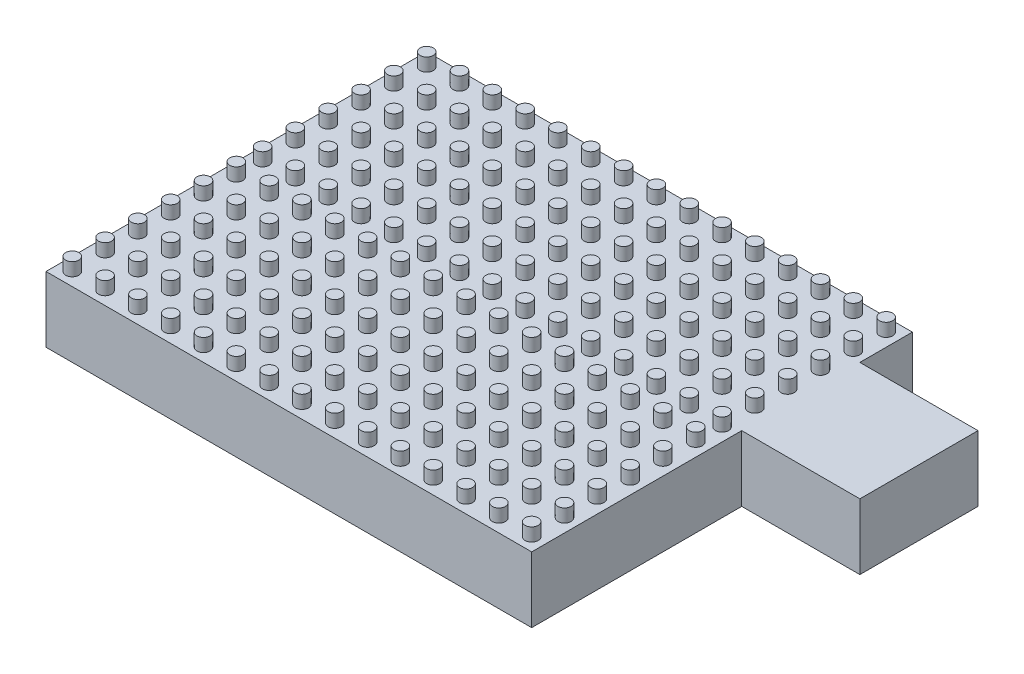
from build123d import *

# Parameters (mm, degrees)
SKETCH_1_W      = 740
SKETCH_1_H      = 580
EXTRUDE_1_DEPTH = 100
SKETCH_2_R      = 10
EXTRUDE_3_DEPTH = 20
SKETCH_3_W      = 180
SKETCH_3_H      = 100
EXTRUDE_4_DEPTH = 180


with BuildPart() as part:
    # 草图1 → 凸台-拉伸1 (new body)
    with BuildSketch(Plane(origin=(0, 0, 0), x_dir=(1, 0, 0), z_dir=(0, 1, 0))):
        Rectangle(SKETCH_1_W, SKETCH_1_H)
    extrude(amount=EXTRUDE_1_DEPTH)

    # 草图2 → 凸台-拉伸3 (add)
    with BuildSketch(Plane(origin=(0, 100, 0), x_dir=(1, 0, 0), z_dir=(0, 1, 0))):
        with Locations(Location((-350, 270, 0), (0, 0, 270))):
            Circle(SKETCH_2_R)
        with Locations(Location((-300, 270, 0), (0, 0, 270))):
            Circle(SKETCH_2_R)
        with Locations(Location((-250, 270, 0), (0, 0, 270))):
            Circle(SKETCH_2_R)
        with Locations(Location((-200, 270, 0), (0, 0, 270))):
            Circle(SKETCH_2_R)
        with Locations(Location((-150, 270, 0), (0, 0, 270))):
            Circle(SKETCH_2_R)
        with Locations(Location((-100, 270, 0), (0, 0, 270))):
            Circle(SKETCH_2_R)
        with Locations(Location((-50, 270, 0), (0, 0, 270))):
            Circle(SKETCH_2_R)
        with Locations(Location((0, 270, 0), (0, 0, 270))):
            Circle(SKETCH_2_R)
        with Locations(Location((50, 270, 0), (0, 0, 270))):
            Circle(SKETCH_2_R)
        with Locations(Location((100, 270, 0), (0, 0, 270))):
            Circle(SKETCH_2_R)
        with Locations(Location((150, 270, 0), (0, 0, 270))):
            Circle(SKETCH_2_R)
        with Locations(Location((200, 270, 0), (0, 0, 270))):
            Circle(SKETCH_2_R)
        with Locations(Location((250, 270, 0), (0, 0, 270))):
            Circle(SKETCH_2_R)
        with Locations(Location((300, 270, 0), (0, 0, 270))):
            Circle(SKETCH_2_R)
        with Locations(Location((350, 270, 0), (0, 0, 270))):
            Circle(SKETCH_2_R)
        with Locations(Location((-300, 220, 0), (0, 0, 270))):
            Circle(SKETCH_2_R)
        with Locations(Location((-250, 220, 0), (0, 0, 270))):
            Circle(SKETCH_2_R)
        with Locations(Location((-200, 220, 0), (0, 0, 270))):
            Circle(SKETCH_2_R)
        with Locations(Location((-150, 220, 0), (0, 0, 270))):
            Circle(SKETCH_2_R)
        with Locations(Location((-100, 220, 0), (0, 0, 270))):
            Circle(SKETCH_2_R)
        with Locations(Location((-50, 220, 0), (0, 0, 270))):
            Circle(SKETCH_2_R)
        with Locations(Location((0, 220, 0), (0, 0, 270))):
            Circle(SKETCH_2_R)
        with Locations(Location((50, 220, 0), (0, 0, 270))):
            Circle(SKETCH_2_R)
        with Locations(Location((100, 220, 0), (0, 0, 270))):
            Circle(SKETCH_2_R)
        with Locations(Location((150, 220, 0), (0, 0, 270))):
            Circle(SKETCH_2_R)
        with Locations(Location((200, 220, 0), (0, 0, 270))):
            Circle(SKETCH_2_R)
        with Locations(Location((250, 220, 0), (0, 0, 270))):
            Circle(SKETCH_2_R)
        with Locations(Location((300, 220, 0), (0, 0, 270))):
            Circle(SKETCH_2_R)
        with Locations(Location((350, 220, 0), (0, 0, 270))):
            Circle(SKETCH_2_R)
        with Locations(Location((-300, 170, 0), (0, 0, 270))):
            Circle(SKETCH_2_R)
        with Locations(Location((-250, 170, 0), (0, 0, 270))):
            Circle(SKETCH_2_R)
        with Locations(Location((-200, 170, 0), (0, 0, 270))):
            Circle(SKETCH_2_R)
        with Locations(Location((-150, 170, 0), (0, 0, 270))):
            Circle(SKETCH_2_R)
        with Locations(Location((-100, 170, 0), (0, 0, 270))):
            Circle(SKETCH_2_R)
        with Locations(Location((-50, 170, 0), (0, 0, 270))):
            Circle(SKETCH_2_R)
        with Locations(Location((0, 170, 0), (0, 0, 270))):
            Circle(SKETCH_2_R)
        with Locations(Location((50, 170, 0), (0, 0, 270))):
            Circle(SKETCH_2_R)
        with Locations(Location((100, 170, 0), (0, 0, 270))):
            Circle(SKETCH_2_R)
        with Locations(Location((150, 170, 0), (0, 0, 270))):
            Circle(SKETCH_2_R)
        with Locations(Location((200, 170, 0), (0, 0, 270))):
            Circle(SKETCH_2_R)
        with Locations(Location((250, 170, 0), (0, 0, 270))):
            Circle(SKETCH_2_R)
        with Locations(Location((300, 170, 0), (0, 0, 270))):
            Circle(SKETCH_2_R)
        with Locations(Location((350, 170, 0), (0, 0, 270))):
            Circle(SKETCH_2_R)
        with Locations(Location((-300, 120, 0), (0, 0, 270))):
            Circle(SKETCH_2_R)
        with Locations(Location((-250, 120, 0), (0, 0, 270))):
            Circle(SKETCH_2_R)
        with Locations(Location((-200, 120, 0), (0, 0, 270))):
            Circle(SKETCH_2_R)
        with Locations(Location((-150, 120, 0), (0, 0, 270))):
            Circle(SKETCH_2_R)
        with Locations(Location((-100, 120, 0), (0, 0, 270))):
            Circle(SKETCH_2_R)
        with Locations(Location((-50, 120, 0), (0, 0, 270))):
            Circle(SKETCH_2_R)
        with Locations(Location((0, 120, 0), (0, 0, 270))):
            Circle(SKETCH_2_R)
        with Locations(Location((50, 120, 0), (0, 0, 270))):
            Circle(SKETCH_2_R)
        with Locations(Location((100, 120, 0), (0, 0, 270))):
            Circle(SKETCH_2_R)
        with Locations(Location((150, 120, 0), (0, 0, 270))):
            Circle(SKETCH_2_R)
        with Locations(Location((200, 120, 0), (0, 0, 270))):
            Circle(SKETCH_2_R)
        with Locations(Location((250, 120, 0), (0, 0, 270))):
            Circle(SKETCH_2_R)
        with Locations(Location((300, 120, 0), (0, 0, 270))):
            Circle(SKETCH_2_R)
        with Locations(Location((350, 120, 0), (0, 0, 270))):
            Circle(SKETCH_2_R)
        with Locations(Location((-300, 70, 0), (0, 0, 270))):
            Circle(SKETCH_2_R)
        with Locations(Location((-250, 70, 0), (0, 0, 270))):
            Circle(SKETCH_2_R)
        with Locations(Location((-200, 70, 0), (0, 0, 270))):
            Circle(SKETCH_2_R)
        with Locations(Location((-150, 70, 0), (0, 0, 270))):
            Circle(SKETCH_2_R)
        with Locations(Location((-100, 70, 0), (0, 0, 270))):
            Circle(SKETCH_2_R)
        with Locations(Location((-50, 70, 0), (0, 0, 270))):
            Circle(SKETCH_2_R)
        with Locations(Location((0, 70, 0), (0, 0, 270))):
            Circle(SKETCH_2_R)
        with Locations(Location((50, 70, 0), (0, 0, 270))):
            Circle(SKETCH_2_R)
        with Locations(Location((100, 70, 0), (0, 0, 270))):
            Circle(SKETCH_2_R)
        with Locations(Location((150, 70, 0), (0, 0, 270))):
            Circle(SKETCH_2_R)
        with Locations(Location((200, 70, 0), (0, 0, 270))):
            Circle(SKETCH_2_R)
        with Locations(Location((250, 70, 0), (0, 0, 270))):
            Circle(SKETCH_2_R)
        with Locations(Location((300, 70, 0), (0, 0, 270))):
            Circle(SKETCH_2_R)
        with Locations(Location((350, 70, 0), (0, 0, 270))):
            Circle(SKETCH_2_R)
        with Locations(Location((-300, 20, 0), (0, 0, 270))):
            Circle(SKETCH_2_R)
        with Locations(Location((-250, 20, 0), (0, 0, 270))):
            Circle(SKETCH_2_R)
        with Locations(Location((-200, 20, 0), (0, 0, 270))):
            Circle(SKETCH_2_R)
        with Locations(Location((-150, 20, 0), (0, 0, 270))):
            Circle(SKETCH_2_R)
        with Locations(Location((-100, 20, 0), (0, 0, 270))):
            Circle(SKETCH_2_R)
        with Locations(Location((-50, 20, 0), (0, 0, 270))):
            Circle(SKETCH_2_R)
        with Locations(Location((0, 20, 0), (0, 0, 270))):
            Circle(SKETCH_2_R)
        with Locations(Location((50, 20, 0), (0, 0, 270))):
            Circle(SKETCH_2_R)
        with Locations(Location((100, 20, 0), (0, 0, 270))):
            Circle(SKETCH_2_R)
        with Locations(Location((150, 20, 0), (0, 0, 270))):
            Circle(SKETCH_2_R)
        with Locations(Location((200, 20, 0), (0, 0, 270))):
            Circle(SKETCH_2_R)
        with Locations(Location((250, 20, 0), (0, 0, 270))):
            Circle(SKETCH_2_R)
        with Locations(Location((300, 20, 0), (0, 0, 270))):
            Circle(SKETCH_2_R)
        with Locations(Location((350, 20, 0), (0, 0, 270))):
            Circle(SKETCH_2_R)
        with Locations(Location((-350, 220, 0), (0, 0, 270))):
            Circle(SKETCH_2_R)
        with Locations(Location((-350, 170, 0), (0, 0, 270))):
            Circle(SKETCH_2_R)
        with Locations(Location((-350, 120, 0), (0, 0, 270))):
            Circle(SKETCH_2_R)
        with Locations(Location((-350, 70, 0), (0, 0, 270))):
            Circle(SKETCH_2_R)
        with Locations(Location((-350, 20, 0), (0, 0, 270))):
            Circle(SKETCH_2_R)
        with Locations(Location((350, -270, 0), (0, 0, 270))):
            Circle(SKETCH_2_R)
        with Locations(Location((300, -270, 0), (0, 0, 270))):
            Circle(SKETCH_2_R)
        with Locations(Location((250, -270, 0), (0, 0, 270))):
            Circle(SKETCH_2_R)
        with Locations(Location((200, -270, 0), (0, 0, 270))):
            Circle(SKETCH_2_R)
        with Locations(Location((150, -270, 0), (0, 0, 270))):
            Circle(SKETCH_2_R)
        with Locations(Location((100, -270, 0), (0, 0, 270))):
            Circle(SKETCH_2_R)
        with Locations(Location((50, -270, 0), (0, 0, 270))):
            Circle(SKETCH_2_R)
        with Locations(Location((0, -270, 0), (0, 0, 270))):
            Circle(SKETCH_2_R)
        with Locations(Location((-50, -270, 0), (0, 0, 270))):
            Circle(SKETCH_2_R)
        with Locations(Location((-100, -270, 0), (0, 0, 270))):
            Circle(SKETCH_2_R)
        with Locations(Location((-150, -270, 0), (0, 0, 270))):
            Circle(SKETCH_2_R)
        with Locations(Location((-200, -270, 0), (0, 0, 270))):
            Circle(SKETCH_2_R)
        with Locations(Location((-250, -270, 0), (0, 0, 270))):
            Circle(SKETCH_2_R)
        with Locations(Location((-300, -270, 0), (0, 0, 270))):
            Circle(SKETCH_2_R)
        with Locations(Location((-350, -270, 0), (0, 0, 270))):
            Circle(SKETCH_2_R)
        with Locations(Location((300, -220, 0), (0, 0, 270))):
            Circle(SKETCH_2_R)
        with Locations(Location((250, -220, 0), (0, 0, 270))):
            Circle(SKETCH_2_R)
        with Locations(Location((200, -220, 0), (0, 0, 270))):
            Circle(SKETCH_2_R)
        with Locations(Location((150, -220, 0), (0, 0, 270))):
            Circle(SKETCH_2_R)
        with Locations(Location((100, -220, 0), (0, 0, 270))):
            Circle(SKETCH_2_R)
        with Locations(Location((50, -220, 0), (0, 0, 270))):
            Circle(SKETCH_2_R)
        with Locations(Location((0, -220, 0), (0, 0, 270))):
            Circle(SKETCH_2_R)
        with Locations(Location((-50, -220, 0), (0, 0, 270))):
            Circle(SKETCH_2_R)
        with Locations(Location((-100, -220, 0), (0, 0, 270))):
            Circle(SKETCH_2_R)
        with Locations(Location((-150, -220, 0), (0, 0, 270))):
            Circle(SKETCH_2_R)
        with Locations(Location((-200, -220, 0), (0, 0, 270))):
            Circle(SKETCH_2_R)
        with Locations(Location((-250, -220, 0), (0, 0, 270))):
            Circle(SKETCH_2_R)
        with Locations(Location((-300, -220, 0), (0, 0, 270))):
            Circle(SKETCH_2_R)
        with Locations(Location((-350, -220, 0), (0, 0, 270))):
            Circle(SKETCH_2_R)
        with Locations(Location((300, -170, 0), (0, 0, 270))):
            Circle(SKETCH_2_R)
        with Locations(Location((250, -170, 0), (0, 0, 270))):
            Circle(SKETCH_2_R)
        with Locations(Location((200, -170, 0), (0, 0, 270))):
            Circle(SKETCH_2_R)
        with Locations(Location((150, -170, 0), (0, 0, 270))):
            Circle(SKETCH_2_R)
        with Locations(Location((100, -170, 0), (0, 0, 270))):
            Circle(SKETCH_2_R)
        with Locations(Location((50, -170, 0), (0, 0, 270))):
            Circle(SKETCH_2_R)
        with Locations(Location((0, -170, 0), (0, 0, 270))):
            Circle(SKETCH_2_R)
        with Locations(Location((-50, -170, 0), (0, 0, 270))):
            Circle(SKETCH_2_R)
        with Locations(Location((-100, -170, 0), (0, 0, 270))):
            Circle(SKETCH_2_R)
        with Locations(Location((-150, -170, 0), (0, 0, 270))):
            Circle(SKETCH_2_R)
        with Locations(Location((-200, -170, 0), (0, 0, 270))):
            Circle(SKETCH_2_R)
        with Locations(Location((-250, -170, 0), (0, 0, 270))):
            Circle(SKETCH_2_R)
        with Locations(Location((-300, -170, 0), (0, 0, 270))):
            Circle(SKETCH_2_R)
        with Locations(Location((-350, -170, 0), (0, 0, 270))):
            Circle(SKETCH_2_R)
        with Locations(Location((300, -120, 0), (0, 0, 270))):
            Circle(SKETCH_2_R)
        with Locations(Location((250, -120, 0), (0, 0, 270))):
            Circle(SKETCH_2_R)
        with Locations(Location((200, -120, 0), (0, 0, 270))):
            Circle(SKETCH_2_R)
        with Locations(Location((150, -120, 0), (0, 0, 270))):
            Circle(SKETCH_2_R)
        with Locations(Location((100, -120, 0), (0, 0, 270))):
            Circle(SKETCH_2_R)
        with Locations(Location((50, -120, 0), (0, 0, 270))):
            Circle(SKETCH_2_R)
        with Locations(Location((0, -120, 0), (0, 0, 270))):
            Circle(SKETCH_2_R)
        with Locations(Location((-50, -120, 0), (0, 0, 270))):
            Circle(SKETCH_2_R)
        with Locations(Location((-100, -120, 0), (0, 0, 270))):
            Circle(SKETCH_2_R)
        with Locations(Location((-150, -120, 0), (0, 0, 270))):
            Circle(SKETCH_2_R)
        with Locations(Location((-200, -120, 0), (0, 0, 270))):
            Circle(SKETCH_2_R)
        with Locations(Location((-250, -120, 0), (0, 0, 270))):
            Circle(SKETCH_2_R)
        with Locations(Location((-300, -120, 0), (0, 0, 270))):
            Circle(SKETCH_2_R)
        with Locations(Location((-350, -120, 0), (0, 0, 270))):
            Circle(SKETCH_2_R)
        with Locations(Location((300, -70, 0), (0, 0, 270))):
            Circle(SKETCH_2_R)
        with Locations(Location((250, -70, 0), (0, 0, 270))):
            Circle(SKETCH_2_R)
        with Locations(Location((200, -70, 0), (0, 0, 270))):
            Circle(SKETCH_2_R)
        with Locations(Location((150, -70, 0), (0, 0, 270))):
            Circle(SKETCH_2_R)
        with Locations(Location((100, -70, 0), (0, 0, 270))):
            Circle(SKETCH_2_R)
        with Locations(Location((50, -70, 0), (0, 0, 270))):
            Circle(SKETCH_2_R)
        with Locations(Location((0, -70, 0), (0, 0, 270))):
            Circle(SKETCH_2_R)
        with Locations(Location((-50, -70, 0), (0, 0, 270))):
            Circle(SKETCH_2_R)
        with Locations(Location((-100, -70, 0), (0, 0, 270))):
            Circle(SKETCH_2_R)
        with Locations(Location((-150, -70, 0), (0, 0, 270))):
            Circle(SKETCH_2_R)
        with Locations(Location((-200, -70, 0), (0, 0, 270))):
            Circle(SKETCH_2_R)
        with Locations(Location((-250, -70, 0), (0, 0, 270))):
            Circle(SKETCH_2_R)
        with Locations(Location((-300, -70, 0), (0, 0, 270))):
            Circle(SKETCH_2_R)
        with Locations(Location((-350, -70, 0), (0, 0, 270))):
            Circle(SKETCH_2_R)
        with Locations(Location((300, -20, 0), (0, 0, 270))):
            Circle(SKETCH_2_R)
        with Locations(Location((250, -20, 0), (0, 0, 270))):
            Circle(SKETCH_2_R)
        with Locations(Location((200, -20, 0), (0, 0, 270))):
            Circle(SKETCH_2_R)
        with Locations(Location((150, -20, 0), (0, 0, 270))):
            Circle(SKETCH_2_R)
        with Locations(Location((100, -20, 0), (0, 0, 270))):
            Circle(SKETCH_2_R)
        with Locations(Location((50, -20, 0), (0, 0, 270))):
            Circle(SKETCH_2_R)
        with Locations(Location((0, -20, 0), (0, 0, 270))):
            Circle(SKETCH_2_R)
        with Locations(Location((-50, -20, 0), (0, 0, 270))):
            Circle(SKETCH_2_R)
        with Locations(Location((-100, -20, 0), (0, 0, 270))):
            Circle(SKETCH_2_R)
        with Locations(Location((-150, -20, 0), (0, 0, 270))):
            Circle(SKETCH_2_R)
        with Locations(Location((-200, -20, 0), (0, 0, 270))):
            Circle(SKETCH_2_R)
        with Locations(Location((-250, -20, 0), (0, 0, 270))):
            Circle(SKETCH_2_R)
        with Locations(Location((-300, -20, 0), (0, 0, 270))):
            Circle(SKETCH_2_R)
        with Locations(Location((-350, -20, 0), (0, 0, 270))):
            Circle(SKETCH_2_R)
        with Locations(Location((350, -220, 0), (0, 0, 270))):
            Circle(SKETCH_2_R)
        with Locations(Location((350, -170, 0), (0, 0, 270))):
            Circle(SKETCH_2_R)
        with Locations(Location((350, -120, 0), (0, 0, 270))):
            Circle(SKETCH_2_R)
        with Locations(Location((350, -70, 0), (0, 0, 270))):
            Circle(SKETCH_2_R)
        with Locations(Location((350, -20, 0), (0, 0, 270))):
            Circle(SKETCH_2_R)
    extrude(amount=EXTRUDE_3_DEPTH)

    # 草图3 → 凸台-拉伸4 (add)
    with BuildSketch(Plane.ZY.offset(-370)):
        with Locations((-120, 50)):
            Rectangle(SKETCH_3_W, SKETCH_3_H)
    extrude(amount=-EXTRUDE_4_DEPTH)


solid = part.part
